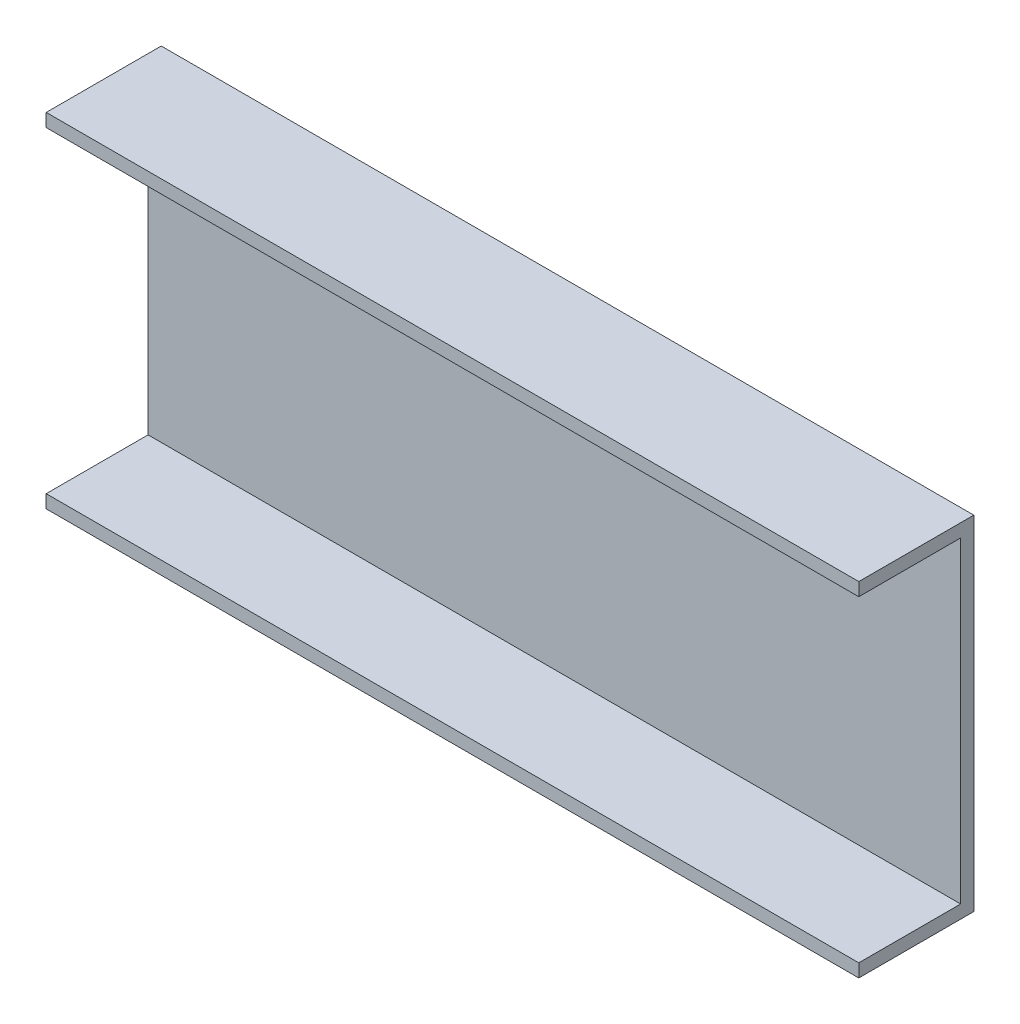
from build123d import *

# Parameters (mm, degrees)
SKETCH_1_W      = 710
SKETCH_1_H      = 300
EXTRUDE_1_DEPTH = 11.5
SKETCH_3_W      = 710
SKETCH_3_H      = 11.5
EXTRUDE_2_DEPTH = 89


with BuildPart() as part:
    # 草图1 → 凸台-拉伸1 (new body)
    with BuildSketch(Plane.XY):
        Rectangle(SKETCH_1_W, SKETCH_1_H)
    extrude(amount=EXTRUDE_1_DEPTH)

    # 草图3 → 凸台-拉伸2 (add)
    with BuildSketch(Plane.XY.offset(11.5)):
        with Locations((0, 144.25)):
            Rectangle(SKETCH_3_W, SKETCH_3_H)
    extrude_2 = extrude(amount=EXTRUDE_2_DEPTH)

    # 镜向1: 凸台-拉伸2 across plane
    add(extrude_2.mirror(Plane.ZX))


solid = part.part
